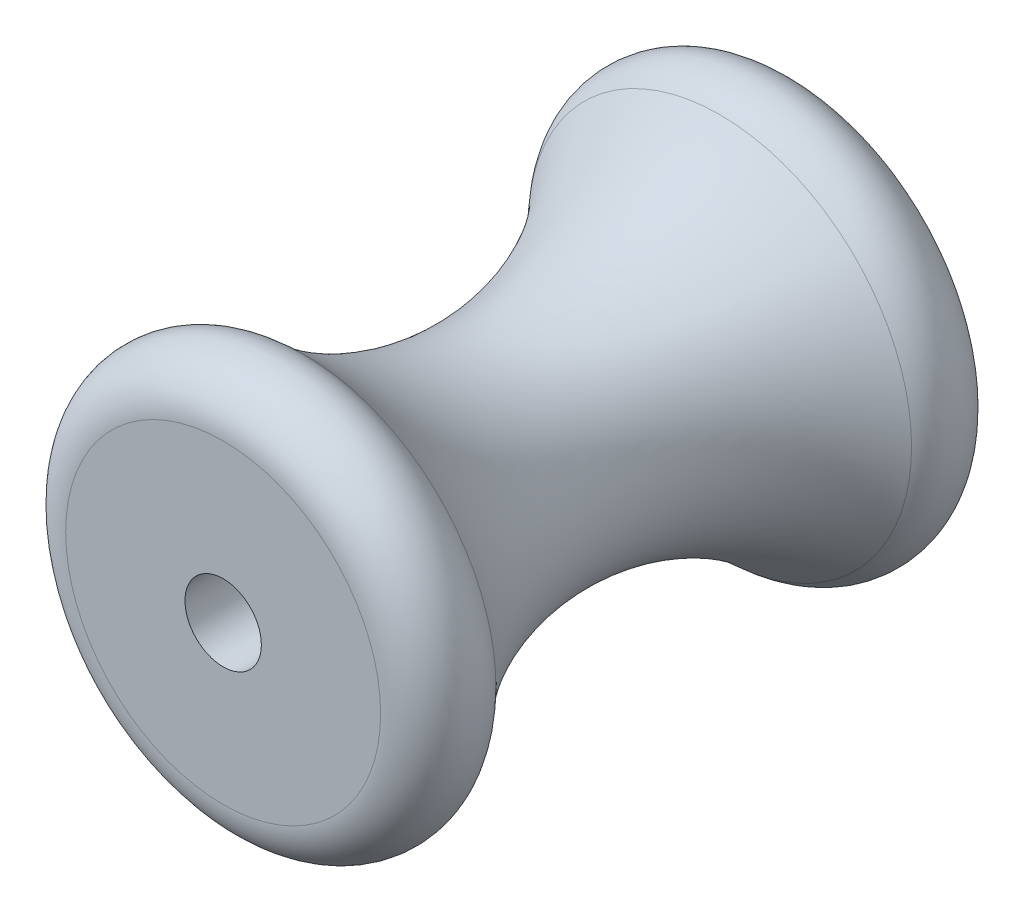
from build123d import *

# Parameters (mm, degrees)
FILLET1_R = 2


with BuildPart() as part:
    # Sketch1 → Revolve1 (revolve)
    with BuildSketch(Plane(origin=(0, 0, 0), x_dir=(0, 0, -1), z_dir=(1, 0, 0))):
        with BuildLine():
            Line((12.1, 1.6), (12.1, 13.863122572))
            ThreePointArc((12.1, 13.863122572), (0, 4.5), (-12.1, 13.863122572))
            Line((-12.1, 13.863122572), (-12.1, 1.6))
            Line((-12.1, 1.6), (12.1, 1.6))
        make_face()
    revolve(axis=Axis((0, 0, -12.5), (0, 0, 1)))

    # Fillet1
    fillet1_edges = [part.edges().sort_by_distance(p)[0] for p in [
        (0, -13.863122572, 12.1),
        (0, -13.863122572, -12.1),
    ]]
    fillet(fillet1_edges, radius=FILLET1_R)


solid = part.part
